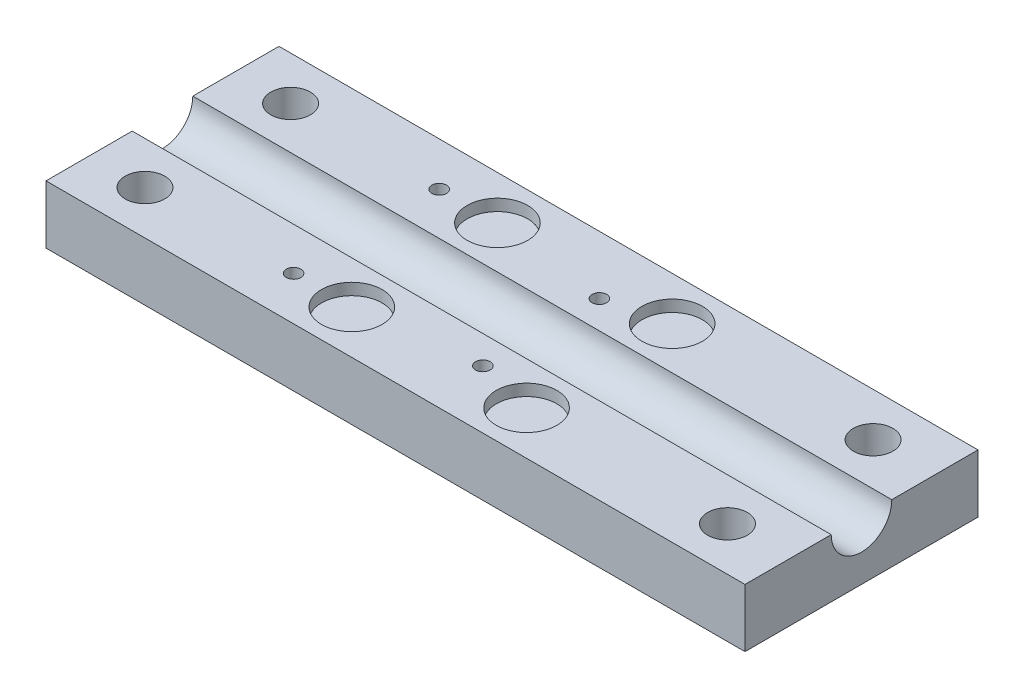
from build123d import *

# Parameters (mm, degrees)
SKETCH1_W           = 76.2
SKETCH1_H           = 25.4
BOSS_EXTRUDE1_DEPTH = 6.35
SKETCH2_R           = 2.159
CUT_EXTRUDE1_DEPTH  = 41.659838908
SKETCH3_R           = 3.302
CUT_EXTRUDE2_DEPTH  = 1.27
SKETCH4_R           = 0.79375
CUT_EXTRUDE3_DEPTH  = 41.659838908
SKETCH5_R           = 3.302
CUT_EXTRUDE4_DEPTH  = 78.51162816


with BuildPart() as part:
    # Sketch1 → Boss-Extrude1 (new body)
    with BuildSketch(Plane(origin=(0, 0, 0), x_dir=(1, 0, 0), z_dir=(0, 1, 0))):
        Rectangle(SKETCH1_W, SKETCH1_H)
    extrude(amount=BOSS_EXTRUDE1_DEPTH)

    # Sketch2 → Cut-Extrude1 (cut, through all)
    with BuildSketch(Plane(origin=(0, 6.35, 0), x_dir=(1, 0, 0), z_dir=(0, 1, 0))):
        with Locations(Location((-32.074075882, 7.9375, 0), (0, 0, 270))):
            Circle(SKETCH2_R)
        with Locations(Location((-32.074075882, -7.9375, 0), (0, 0, 270))):
            Circle(SKETCH2_R)
        with Locations(Location((31.425924118, 7.9375, 0), (0, 0, 270))):
            Circle(SKETCH2_R)
        with Locations(Location((31.425924118, -7.9375, 0), (0, 0, 270))):
            Circle(SKETCH2_R)
    extrude(amount=-CUT_EXTRUDE1_DEPTH, mode=Mode.SUBTRACT)

    # Sketch3 → Cut-Extrude2 (cut)
    with BuildSketch(Plane(origin=(0, 6.35, 0), x_dir=(1, 0, 0), z_dir=(0, 1, 0))):
        with Locations(Location((-9.525, 7.9375, 0), (0, 0, 270))):
            Circle(SKETCH3_R)
        with Locations(Location((-9.525, -7.9375, 0), (0, 0, 270))):
            Circle(SKETCH3_R)
        with Locations(Location((9.525, -7.9375, 0), (0, 0, 270))):
            Circle(SKETCH3_R)
        with Locations(Location((9.525, 7.9375, 0), (0, 0, 270))):
            Circle(SKETCH3_R)
    extrude(amount=-CUT_EXTRUDE2_DEPTH, mode=Mode.SUBTRACT)

    # Sketch4 → Cut-Extrude3 (cut, through all)
    with BuildSketch(Plane(origin=(0, 6.35, 0), x_dir=(1, 0, 0), z_dir=(0, 1, 0))):
        with Locations(Location((-15.875, 7.9375, 0), (0, 0, 270))):
            Circle(SKETCH4_R)
        with Locations(Location((-15.875, -7.9375, 0), (0, 0, 270))):
            Circle(SKETCH4_R)
        with Locations(Location((3.175, 6.35, 0), (0, 0, 270))):
            Circle(SKETCH4_R)
        with Locations(Location((3.175, -6.35, 0), (0, 0, 270))):
            Circle(SKETCH4_R)
    extrude(amount=-CUT_EXTRUDE3_DEPTH, mode=Mode.SUBTRACT)

    # Sketch5 → Cut-Extrude4 (cut, through all)
    with BuildSketch(Plane.ZY.offset(38.1)):
        with Locations((0, 6.35)):
            Circle(SKETCH5_R)
    extrude(amount=-CUT_EXTRUDE4_DEPTH, mode=Mode.SUBTRACT)


solid = part.part
